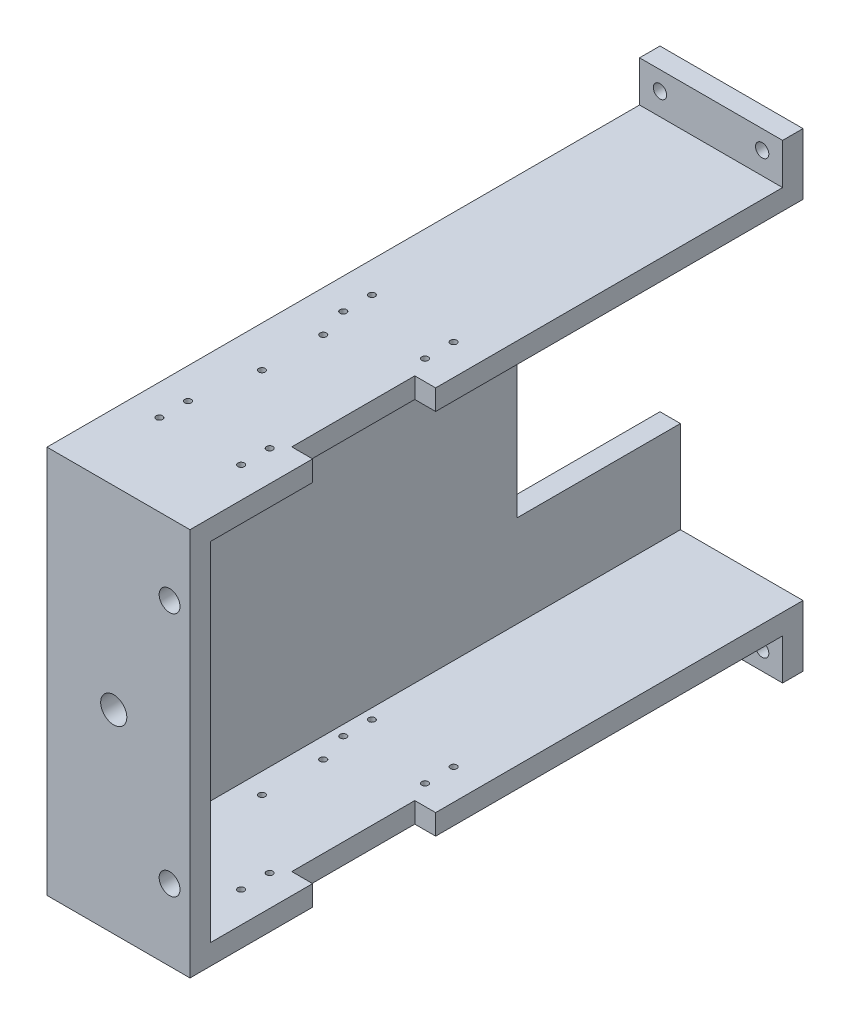
from build123d import *

# Parameters (mm, degrees)
SKETCH1_W               = 44.45
SKETCH1_H               = 120.65
BOSS_EXTRUDE1_DEPTH     = 190.5
SKETCH2_W               = 38.1
SKETCH2_H               = 107.95
CUT_EXTRUDE1_DEPTH      = 184.15
CUT_EXTRUDE4_DEPTH      = 199.811796997
CUT_EXTRUDE4_DEPTH_BACK = 199.811796997
SKETCH4_R               = 3.2385
SKETCH17_W              = 6.477
SKETCH17_H              = 38.227
CUT_EXTRUDE5_DEPTH      = 230.8314056
SKETCH18_W              = 50.8
SKETCH18_H              = 50.8
CUT_EXTRUDE6_DEPTH      = 204.423119691
SKETCH19_W              = 44.45
SKETCH19_H              = 6.35
BOSS_EXTRUDE2_DEPTH     = 12.7
SKETCH21_R              = 2.063500064
SKETCH21_R_2            = 2.063499937
CUT_EXTRUDE7_DEPTH      = 204.02629294
SKETCH23_R              = 4.063500001
CUT_EXTRUDE8_DEPTH      = 209.803024703
SKETCH24_R              = 1.000000032
CUT_EXTRUDE9_DEPTH      = 237.745168905
SKETCH25_R              = 1.000000032
CUT_EXTRUDE10_DEPTH     = 237.745168905
LPATTERN1_COUNT         = 2
LPATTERN1_PITCH         = 57.15


with BuildPart() as part:
    # Sketch1 → Boss-Extrude1 (new body)
    with BuildSketch(Plane.XY):
        with Locations((22.225, 0)):
            Rectangle(SKETCH1_W, SKETCH1_H)
    extrude(amount=BOSS_EXTRUDE1_DEPTH)

    # Sketch2 → Cut-Extrude1 (cut)
    with BuildSketch(Plane(origin=(0, 0, 0), x_dir=(-1, 0, 0), z_dir=(0, 0, -1))):
        with Locations((-25.4, 0)):
            Rectangle(SKETCH2_W, SKETCH2_H)
    extrude(amount=-CUT_EXTRUDE1_DEPTH, mode=Mode.SUBTRACT)

    # Sketch4 → Cut-Extrude4 (cut, two sides: drawn at the far end of the back side and taken through both)
    with BuildSketch(Plane(origin=(0, 0, 184.15), x_dir=(-1, 0, 0), z_dir=(0, 0, -1)).offset(-CUT_EXTRUDE4_DEPTH_BACK)):
        with Locations((-38.1, 38.1)):
            Circle(SKETCH4_R)
        with Locations(Location((-38.1, -38.1, 0), (0, 0, 180))):
            Circle(SKETCH4_R)
    extrude(amount=CUT_EXTRUDE4_DEPTH + CUT_EXTRUDE4_DEPTH_BACK, mode=Mode.SUBTRACT)

    # Sketch17 → Cut-Extrude5 (cut, through all)
    with BuildSketch(Plane.XZ.offset(60.325)):
        with Locations((41.2115, 133.2865)):
            Rectangle(SKETCH17_W, SKETCH17_H)
    extrude(amount=-CUT_EXTRUDE5_DEPTH, mode=Mode.SUBTRACT)

    # Sketch18 → Cut-Extrude6 (cut, through all)
    with BuildSketch(Plane(origin=(6.35, 0, 0), x_dir=(0, 0, -1), z_dir=(1, 0, 0))):
        with Locations((-25.4, 0)):
            Rectangle(SKETCH18_W, SKETCH18_H)
    extrude(amount=-CUT_EXTRUDE6_DEPTH, mode=Mode.SUBTRACT)

    # Sketch19 → Boss-Extrude2 (add)
    with BuildSketch(Plane.XZ.offset(60.325)):
        with Locations((22.225, 3.175)):
            Rectangle(SKETCH19_W, SKETCH19_H)
    boss_extrude2 = extrude(amount=BOSS_EXTRUDE2_DEPTH)

    # Sketch21 → Cut-Extrude7 (cut, through all)
    with BuildSketch(Plane.XY.offset(6.35)):
        with Locations((6.35, -67.197573915)):
            Circle(SKETCH21_R)
        with Locations((38.1, -67.197573915)):
            Circle(SKETCH21_R_2)
    cut_extrude7 = extrude(amount=-CUT_EXTRUDE7_DEPTH, mode=Mode.SUBTRACT)

    # Mirror1: Boss-Extrude2, Cut-Extrude7 across plane
    add(boss_extrude2.mirror(Plane.ZX))
    add(cut_extrude7.mirror(Plane.ZX), mode=Mode.SUBTRACT)

    # Sketch23 → Cut-Extrude8 (cut, through all)
    with BuildSketch(Plane.XY.offset(190.5)):
        with Locations((20.7499966, 0)):
            Circle(SKETCH23_R)
    extrude(amount=-CUT_EXTRUDE8_DEPTH, mode=Mode.SUBTRACT)

    # Sketch24 → Cut-Extrude9 (cut, through all)
    with BuildSketch(Plane.XZ.offset(60.325)):
        with Locations(Location((12.7, 117.348, 0), (0, 0, 270))):
            Circle(SKETCH24_R)
        with Locations(Location((12.7, 136.398, 0), (0, 0, 270))):
            Circle(SKETCH24_R)
    extrude(amount=-CUT_EXTRUDE9_DEPTH, mode=Mode.SUBTRACT)

    # Sketch25 → Cut-Extrude10 (cut, through all)
    with BuildSketch(Plane.XZ.offset(60.325)):
        with Locations(Location((9.525, 156.21, 0), (0, 0, 270))):
            Circle(SKETCH25_R)
        with Locations(Location((34.925, 156.21, 0), (0, 0, 270))):
            Circle(SKETCH25_R)
        with Locations(Location((34.925, 165.1, 0), (0, 0, 270))):
            Circle(SKETCH25_R)
        with Locations(Location((9.525, 165.1, 0), (0, 0, 270))):
            Circle(SKETCH25_R)
    cut_extrude10 = extrude(amount=-CUT_EXTRUDE10_DEPTH, mode=Mode.SUBTRACT)

    # LPattern1: Cut-Extrude10 ×2
    with Locations(*[(0, 0, -i * LPATTERN1_PITCH) for i in range(1, LPATTERN1_COUNT)]):
        add(cut_extrude10, mode=Mode.SUBTRACT)


solid = part.part
